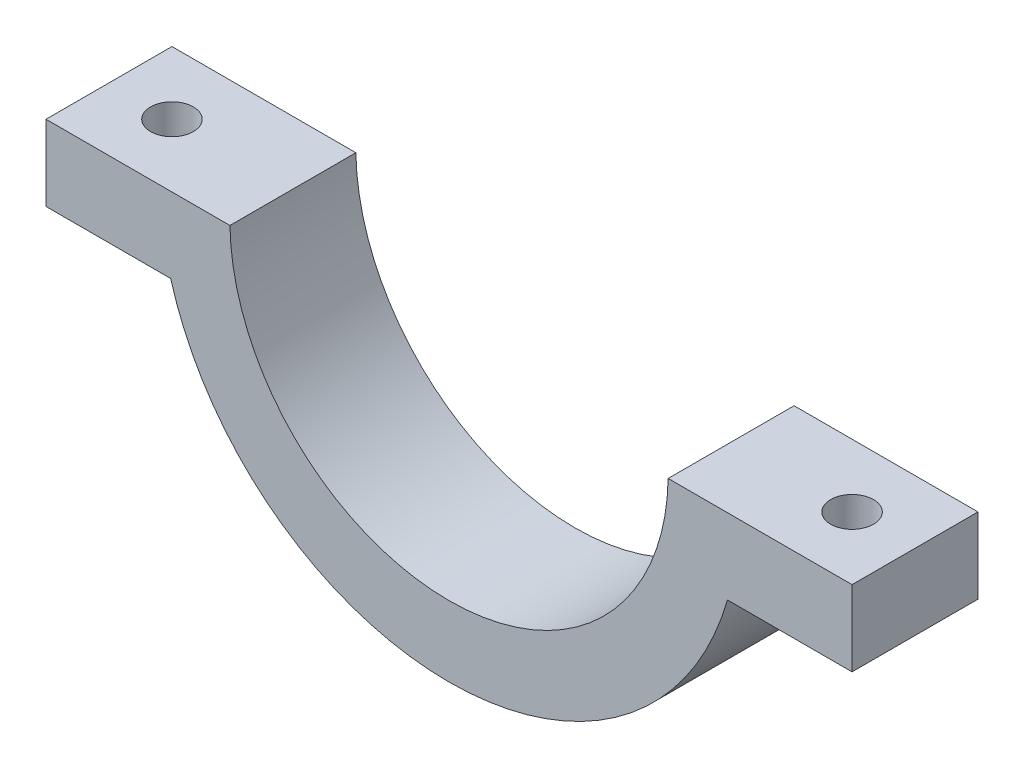
from build123d import *

# Parameters (mm, degrees)
F_01_REAR_SEMICIRCULAR_CAP_AND_BOLT_EARS_DEPTH = 10
F_02_START                                     = -0.2
S02_MATING_MOTOR_CAN_R                         = 17.4
F_02_MATING_MOTOR_CAN_DEPTH                    = 10.4
F_03_START                                     = -6.5
S03_TWO_M3_CLAMP_SCREWS_R                      = 1.7
F_03_TWO_M3_CLAMP_SCREWS_DEPTH                 = 6.7


with BuildPart() as part:
    # S01 - Rear semicircular cap and bolt ears → 01 - Rear semicircular cap and bolt ears (new body)
    with BuildSketch(Plane.XY):
        with BuildLine():
            Line((-32, -0.3), (-32, -6.3))
            Line((-32, -6.3), (-22.1, -6.3))
            ThreePointArc((-22.1, -6.3), (0, -23), (22.1, -6.3))
            Line((22.1, -6.3), (32, -6.3))
            Line((32, -6.3), (32, -0.3))
            Line((32, -0.3), (-32, -0.3))
        make_face()
    extrude(amount=F_01_REAR_SEMICIRCULAR_CAP_AND_BOLT_EARS_DEPTH)

    # S02 - Mating motor can → 02 - Mating motor can (cut)
    with BuildSketch(Plane.XY.offset(F_02_START)):
        Circle(S02_MATING_MOTOR_CAN_R)
    extrude(amount=F_02_MATING_MOTOR_CAN_DEPTH, mode=Mode.SUBTRACT)

    # S03 - Two M3 clamp screws → 03 - Two M3 clamp screws (cut)
    with BuildSketch(Plane(origin=(0, 0, 0), x_dir=(1, 0, 0), z_dir=(0, 1, 0)).offset(F_03_START)):
        with Locations(Location((-27, -5, 0), (0, 0, 90))):
            Circle(S03_TWO_M3_CLAMP_SCREWS_R)
        with Locations(Location((27, -5, 0), (0, 0, 90))):
            Circle(S03_TWO_M3_CLAMP_SCREWS_R)
    extrude(amount=F_03_TWO_M3_CLAMP_SCREWS_DEPTH, mode=Mode.SUBTRACT)


solid = part.part
